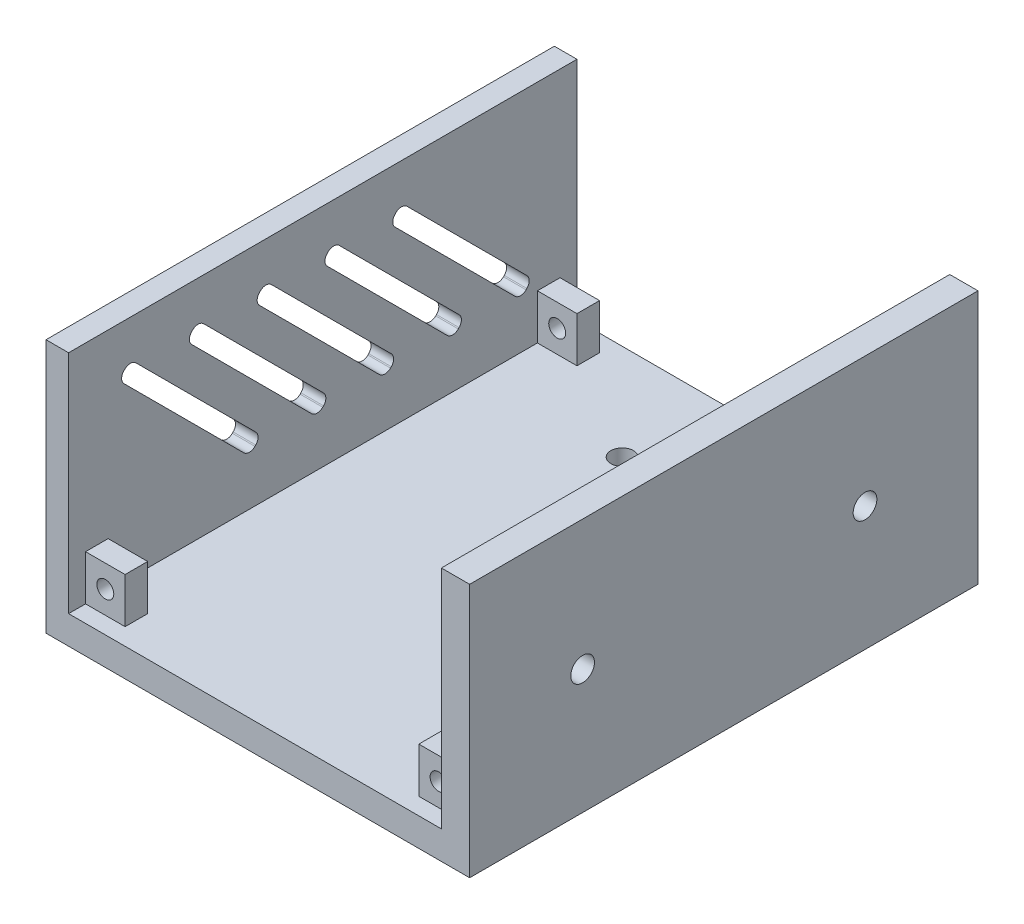
from build123d import *

# Parameters (mm, degrees)
SKETCH1_W                                           = 75
SKETCH1_H                                           = 5
SKETCH1_W_2                                         = 5
SKETCH1_H_2                                         = 40
BOSS_EXTRUDE1_DEPTH                                 = 90
SKETCH2_R                                           = 2.1
CUT_EXTRUDE1_DEPTH                                  = 122.680935236
SKETCH4_W                                           = 4
SKETCH4_H                                           = 90
BOSS_EXTRUDE2_DEPTH                                 = 40
SKETCH6_W                                           = 7
SKETCH6_H                                           = 4
BOSS_EXTRUDE4_DEPTH                                 = 8
SKETCH7_R                                           = 1.6
CUT_EXTRUDE3_DEPTH                                  = 106.386194542
CUT_EXTRUDE4_REACH                                  = 126.624
LPATTERN1_COUNT                                     = 5
LPATTERN1_PITCH                                     = 12
SKETCH9_R                                           = 1.5
CUT_EXTRUDE5_DEPTH                                  = 104.834002138
CSK_FOR_M4_COUNTERSUNK_FLAT_HEAD_SCREW1_D           = 4
CSK_FOR_M4_COUNTERSUNK_FLAT_HEAD_SCREW1_CSINK_D     = 7.5
CSK_FOR_M4_COUNTERSUNK_FLAT_HEAD_SCREW1_CSINK_ANGLE = 90


with BuildPart() as part:
    # Sketch1 → Boss-Extrude1 (new body)
    with BuildSketch(Plane.XY):
        Rectangle(SKETCH1_W, SKETCH1_H)
        with Locations((35, 22.5)):
            Rectangle(SKETCH1_W_2, SKETCH1_H_2)
    extrude(amount=BOSS_EXTRUDE1_DEPTH)

    # Sketch2 → Cut-Extrude1 (cut, through all)
    with BuildSketch(Plane.ZY.offset(-32.5)):
        with Locations((20, 19.5)):
            Circle(SKETCH2_R)
        with Locations((70, 19.5)):
            Circle(SKETCH2_R)
    extrude(amount=-CUT_EXTRUDE1_DEPTH, mode=Mode.SUBTRACT)

    # Sketch4 → Boss-Extrude2 (add)
    with BuildSketch(Plane(origin=(0, 2.5, 0), x_dir=(1, 0, 0), z_dir=(0, 1, 0))):
        with Locations((-35.5, -45)):
            Rectangle(SKETCH4_W, SKETCH4_H)
    extrude(amount=BOSS_EXTRUDE2_DEPTH)

    # Sketch6 → Boss-Extrude4 (add)
    with BuildSketch(Plane(origin=(0, 2.5, 0), x_dir=(1, 0, 0), z_dir=(0, 1, 0))):
        with Locations((-30, -5)):
            Rectangle(SKETCH6_W, SKETCH6_H)
        with Locations((29, -5)):
            Rectangle(SKETCH6_W, SKETCH6_H)
        with Locations((29, -85)):
            Rectangle(SKETCH6_W, SKETCH6_H)
        with Locations((-30, -85)):
            Rectangle(SKETCH6_W, SKETCH6_H)
    extrude(amount=BOSS_EXTRUDE4_DEPTH)

    # Sketch7 → Cut-Extrude3 (cut, through all)
    with BuildSketch(Plane(origin=(0, 2.5, 0), x_dir=(1, 0, 0), z_dir=(0, 1, 0))):
        with Locations(Location((24.5, -68, 0), (0, 0, 180))):
            Circle(SKETCH7_R)
        with Locations(Location((-8.5, -17, 0), (0, 0, 180))):
            Circle(SKETCH7_R)
    extrude(amount=-CUT_EXTRUDE3_DEPTH, mode=Mode.SUBTRACT)

    # Sketch8 → Cut-Extrude4 (cut, up to next)
    with BuildSketch(Plane.ZY.offset(37.5), mode=Mode.PRIVATE) as cut_extrude4_sk1:
        with BuildLine():
            Line((32.061260163, 34.989949494), (32.202681519, 34.848528137))
            ThreePointArc((32.202681519, 34.848528137), (32.612732026, 33.858578644), (32.202681519, 32.86862915))
            Line((32.202681519, 32.86862915), (10.989949494, 11.655897124))
            ThreePointArc((10.989949494, 11.655897124), (10, 11.245846618), (9.010050506, 11.655897124))
            Line((9.010050506, 11.655897124), (8.86862915, 11.797318481))
            ThreePointArc((8.86862915, 11.797318481), (8.458578644, 12.787267974), (8.86862915, 13.777217468))
            Line((8.86862915, 13.777217468), (30.081361176, 34.989949494))
            ThreePointArc((30.081361176, 34.989949494), (31.07131067, 35.4), (32.061260163, 34.989949494))
        make_face()
    cut_extrude4_tool1 = extrude(cut_extrude4_sk1.sketch, amount=-CUT_EXTRUDE4_REACH, mode=Mode.PRIVATE) & part.part
    cut_extrude4 = cut_extrude4_tool1.solids().sort_by_distance((-37.5, 23.322923, 20.535655))[0]
    add(cut_extrude4, mode=Mode.SUBTRACT)

    # LPattern1: Cut-Extrude4 ×5
    with Locations(*[(0, 0, i * LPATTERN1_PITCH) for i in range(1, LPATTERN1_COUNT)]):
        add(cut_extrude4, mode=Mode.SUBTRACT)

    # Sketch9 → Cut-Extrude5 (cut, through all)
    with BuildSketch(Plane.XY.offset(87)):
        with Locations((-30, 6.5)):
            Circle(SKETCH9_R)
        with Locations((29, 6.5)):
            Circle(SKETCH9_R)
    extrude(amount=-CUT_EXTRUDE5_DEPTH, mode=Mode.SUBTRACT)

    # CSK for M4 Countersunk Flat Head Screw1 (through all)
    with Locations(Plane(origin=(24.5, -2.5, 68), x_dir=(0, 0, -1), z_dir=(0, -1, 0))):
        with Locations((0, 0), (51, -33)):
            CounterSinkHole(CSK_FOR_M4_COUNTERSUNK_FLAT_HEAD_SCREW1_D / 2, CSK_FOR_M4_COUNTERSUNK_FLAT_HEAD_SCREW1_CSINK_D / 2, counter_sink_angle=CSK_FOR_M4_COUNTERSUNK_FLAT_HEAD_SCREW1_CSINK_ANGLE)


solid = part.part
